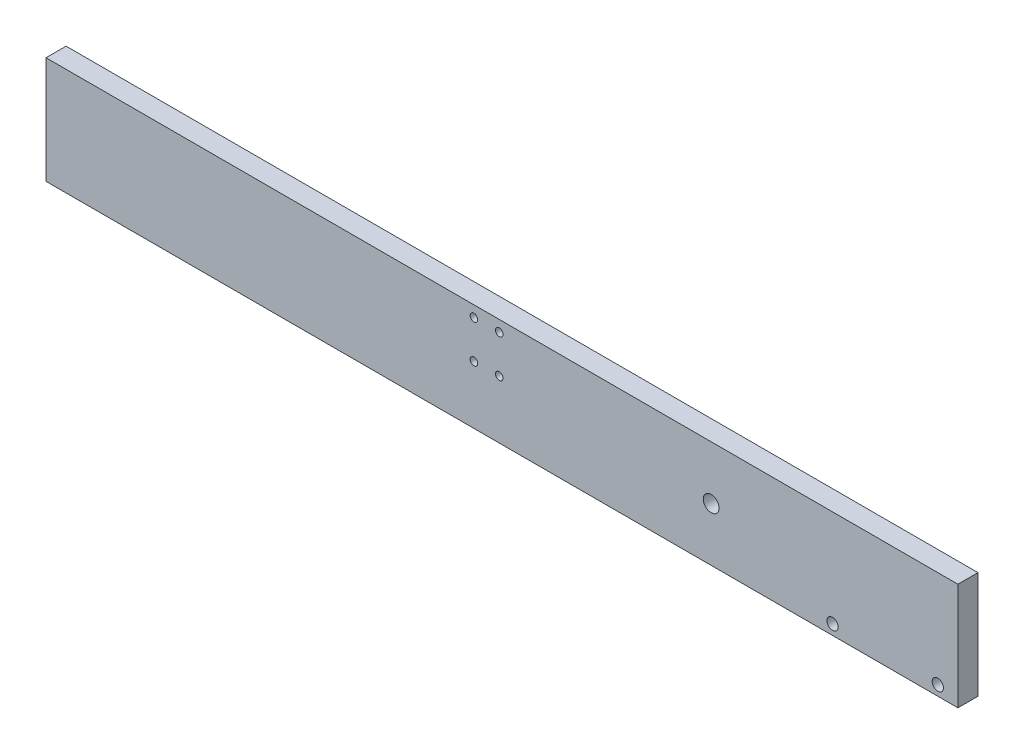
from build123d import *

# Parameters (mm, degrees)
SKETCH1_W           = 288.29
SKETCH1_H           = 33.85
SKETCH1_R           = 1.7859375
SKETCH1_R_2         = 2.5
SKETCH1_R_3         = 1.2
BOSS_EXTRUDE1_DEPTH = 6.35


with BuildPart() as part:
    # Sketch1 → Boss-Extrude1 (new body)
    with BuildSketch(Plane.XY):
        with Locations((144.145, 16.925)):
            Rectangle(SKETCH1_W, SKETCH1_H)
        with Locations((281.94, 3.175)):
            Circle(SKETCH1_R, mode=Mode.SUBTRACT)
        with Locations((210.29, 16.925)):
            Circle(SKETCH1_R_2, mode=Mode.SUBTRACT)
        with Locations((135.29, 30.35)):
            Circle(SKETCH1_R_3, mode=Mode.SUBTRACT)
        with Locations((135.29, 18.35)):
            Circle(SKETCH1_R_3, mode=Mode.SUBTRACT)
        with Locations((143.29, 18.35)):
            Circle(SKETCH1_R_3, mode=Mode.SUBTRACT)
        with Locations((143.29, 30.35)):
            Circle(SKETCH1_R_3, mode=Mode.SUBTRACT)
        with Locations((248.64, 3.175)):
            Circle(SKETCH1_R, mode=Mode.SUBTRACT)
    extrude(amount=BOSS_EXTRUDE1_DEPTH)


solid = part.part
